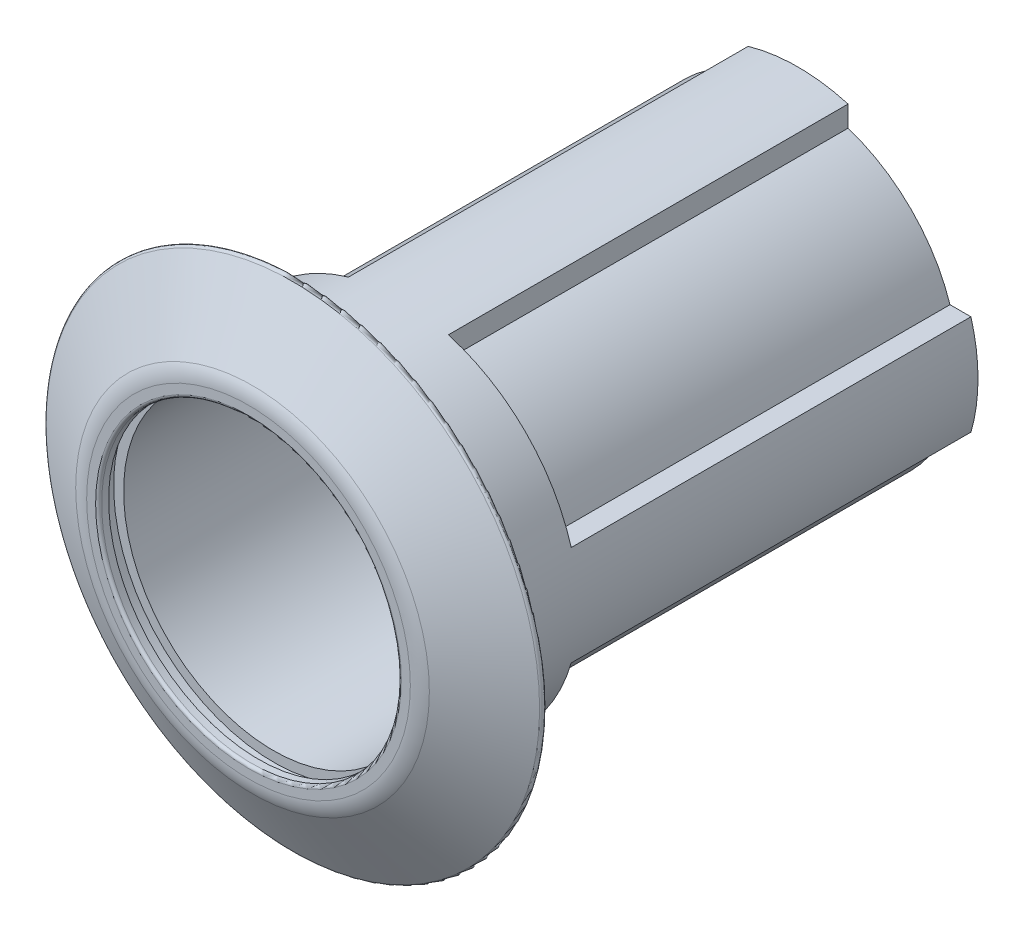
from build123d import *

# Parameters (mm, degrees)
CUT_EXTRUDE_1_DEPTH = 40


with BuildPart() as part:
    # 草图1 → 旋转1 (revolve)
    with BuildSketch(Plane(origin=(0, 0, 0), x_dir=(0, 0, -1), z_dir=(1, 0, 0)), mode=Mode.PRIVATE) as revolve_1_sk:
        with BuildLine():
            Line((0, 15.3), (0, 16.196152423))
            ThreePointArc((0, 16.196152423), (0.102222521, 16.972609558), (0.401923789, 17.696152423))
            Line((0.401923789, 17.696152423), (4.440192379, 24.690638796))
            ThreePointArc((4.440192379, 24.690638796), (4.777645714, 24.830416543), (5, 24.540638796))
            Line((5, 24.540638796), (5, 18))
            Line((5, 18), (55, 18))
            Line((55, 18), (55, 15))
            Line((55, 15), (2.5, 15))
            Line((2.5, 15), (2.5, 16))
            Line((2.5, 16), (1, 16))
            Line((1, 16), (1, 15))
            Line((1, 15), (0.3, 15))
            ThreePointArc((0.3, 15), (0.087867966, 15.087867966), (0, 15.3))
        make_face()
    revolve(revolve_1_sk.sketch.rotate(Axis((0, 0, 31.844262295), (0, 0, -1)), 90), axis=Axis((0, 0, 31.844262295), (0, 0, -1)))

    # 草图2 → 切除-拉伸1 (cut)
    with BuildSketch(Plane(origin=(0, 0, -55), x_dir=(-1, 0, 0), z_dir=(0, 0, -1))):
        with BuildLine():
            Line((-5, 17.291616466), (-5, 15.198684154))
            ThreePointArc((-5, 15.198684154), (-11.313708499, 11.313708499), (-15.198684154, 5))
            Line((-15.198684154, 5), (-17.291616466, 5))
            ThreePointArc((-17.291616466, 5), (-12.727922061, 12.727922061), (-5, 17.291616466))
        make_face()
        with BuildLine():
            Line((5, 17.291616466), (5, 15.198684154))
            ThreePointArc((5, 15.198684154), (11.313708499, 11.313708499), (15.198684154, 5))
            Line((15.198684154, 5), (17.291616466, 5))
            ThreePointArc((17.291616466, 5), (12.727922061, 12.727922061), (5, 17.291616466))
        make_face()
        with BuildLine():
            Line((-17.291616466, -5), (-15.198684154, -5))
            ThreePointArc((-15.198684154, -5), (-11.313708499, -11.313708499), (-5, -15.198684154))
            Line((-5, -15.198684154), (-5, -17.291616466))
            ThreePointArc((-5, -17.291616466), (-12.727922061, -12.727922061), (-17.291616466, -5))
        make_face()
        with BuildLine():
            Line((15.198684154, -5), (17.291616466, -5))
            ThreePointArc((17.291616466, -5), (12.727922061, -12.727922061), (5, -17.291616466))
            Line((5, -17.291616466), (5, -15.198684154))
            ThreePointArc((5, -15.198684154), (11.313708499, -11.313708499), (15.198684154, -5))
        make_face()
    extrude(amount=-CUT_EXTRUDE_1_DEPTH, mode=Mode.SUBTRACT)


solid = part.part
